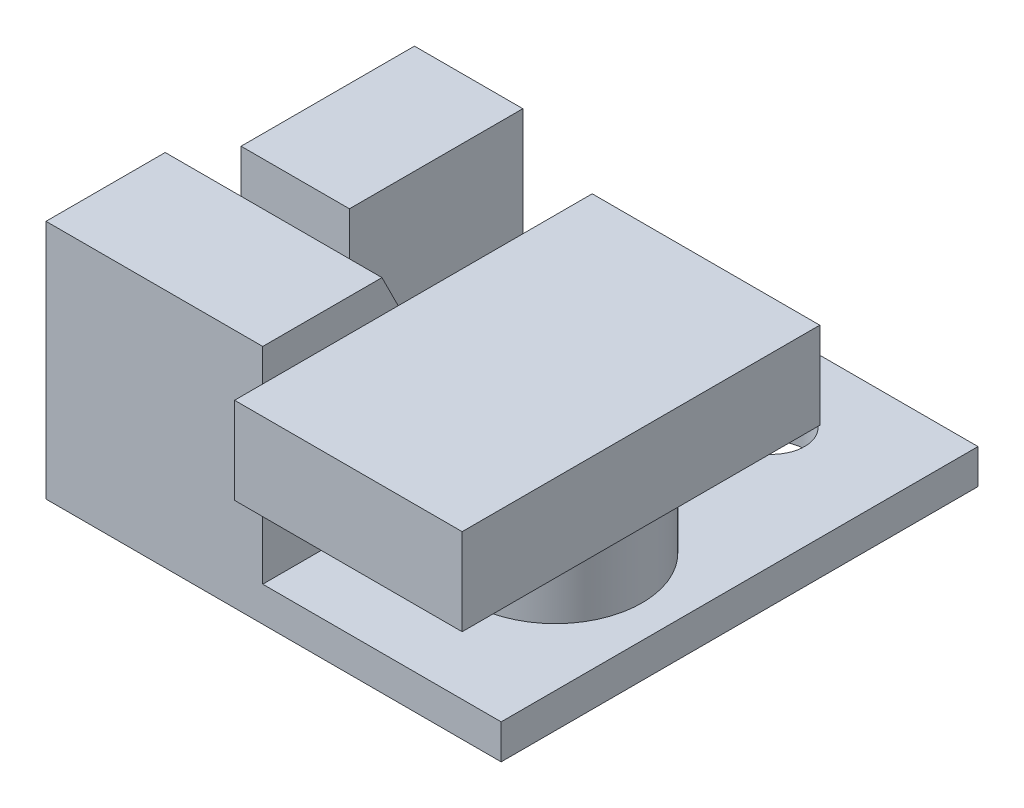
from build123d import *

# Parameters (mm, degrees)
SKETCH1_W           = 21
SKETCH1_H           = 22
BOSS_EXTRUDE1_DEPTH = 1.6
SKETCH2_R           = 1.5
CUT_EXTRUDE1_DEPTH  = 1.6
SKETCH3_W           = 5
SKETCH3_H           = 8
BOSS_EXTRUDE2_DEPTH = 8.5
SKETCH4_W           = 10
SKETCH4_H           = 7.5
BOSS_EXTRUDE3_DEPTH = 9.5
CHAMFER1_SIZE       = 4
CHAMFER1_SIZE2      = 2
SKETCH5_R           = 4
BOSS_EXTRUDE4_DEPTH = 4.5
SKETCH6_W           = 10.5
SKETCH6_H           = 16.5
BOSS_EXTRUDE5_DEPTH = 4


with BuildPart() as part:
    # Sketch1 → Boss-Extrude1 (new body)
    with BuildSketch(Plane(origin=(0, 0, 0), x_dir=(1, 0, 0), z_dir=(0, 1, 0))):
        Rectangle(SKETCH1_W, SKETCH1_H)
    extrude(amount=BOSS_EXTRUDE1_DEPTH)

    # Sketch2 → Cut-Extrude1 (cut)
    with BuildSketch(Plane(origin=(0, 1.6, 0), x_dir=(1, 0, 0), z_dir=(0, 1, 0))):
        with Locations(Location((5, 7, 0), (0, 0, 270))):
            Circle(SKETCH2_R)
        Polygon((-12.078029191, 8.5), (-1, 8.5), (1.5, 11), (-12.078029191, 11), align=None)
    extrude(amount=-CUT_EXTRUDE1_DEPTH, mode=Mode.SUBTRACT)

    # Sketch3 → Boss-Extrude2 (add)
    with BuildSketch(Plane(origin=(0, 1.6, 0), x_dir=(1, 0, 0), z_dir=(0, 1, 0))):
        with Locations((-7.5, 1.5)):
            Rectangle(SKETCH3_W, SKETCH3_H)
    extrude(amount=BOSS_EXTRUDE2_DEPTH)

    # Sketch4 → Boss-Extrude3 (add)
    with BuildSketch(Plane(origin=(0, 1.6, 0), x_dir=(1, 0, 0), z_dir=(0, 1, 0))):
        with Locations((-5.5, -7.25)):
            Rectangle(SKETCH4_W, SKETCH4_H)
    extrude(amount=BOSS_EXTRUDE3_DEPTH)

    # Chamfer1
    chamfer1_edges = [part.edges().sort_by_distance(p)[0] for p in [
        (-5.5, 11.1, 3.5),
    ]]
    chamfer1_side = [part.faces().sort_by_distance(p)[0] for p in [
        (-5.5, 6.35, 3.5),
    ]]
    chamfer(chamfer1_edges, length=CHAMFER1_SIZE, length2=CHAMFER1_SIZE2, reference=chamfer1_side[0])

    # Sketch5 → Boss-Extrude4 (add)
    with BuildSketch(Plane(origin=(0, 1.6, 0), x_dir=(1, 0, 0), z_dir=(0, 1, 0))):
        with Locations(Location((5, -3, 0), (0, 0, 270))):
            Circle(SKETCH5_R)
    extrude(amount=BOSS_EXTRUDE4_DEPTH)

    # Sketch6 → Boss-Extrude5 (add)
    with BuildSketch(Plane(origin=(0, 6.1, 0), x_dir=(1, 0, 0), z_dir=(0, 1, 0))):
        with Locations((5.25, -4.55)):
            Rectangle(SKETCH6_W, SKETCH6_H)
    extrude(amount=BOSS_EXTRUDE5_DEPTH)


solid = part.part
